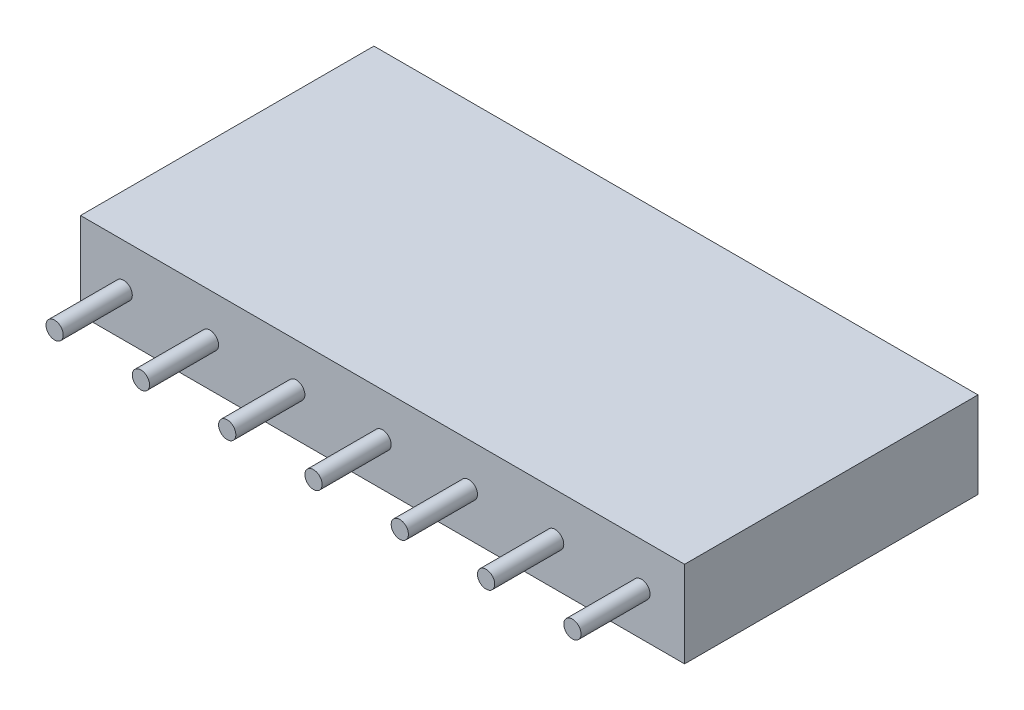
from build123d import *

# Parameters (mm, degrees)
ESQUISSE1_W                = 2.5
ESQUISSE1_H                = 2.5
BOSS_EXTRU_1_DEPTH         = 8.5
ESQUISSE2_R                = 0.25
BOSS_EXTRU_2_DEPTH         = 2
ESQUISSE3_R                = 0.25
ENL_V_MAT_EXTRU_2_DEPTH    = 4
R_P_TITION_LIN_AIRE1_COUNT = 7
R_P_TITION_LIN_AIRE1_PITCH = 2.5


with BuildPart() as part:
    # Esquisse1 → Boss.-Extru.1 (new body)
    with BuildSketch(Plane.XY):
        with Locations((-1.25, 1.25)):
            Rectangle(ESQUISSE1_W, ESQUISSE1_H)
    boss_extru_1 = extrude(amount=BOSS_EXTRU_1_DEPTH)

    # Esquisse2 → Boss.-Extru.2 (add)
    with BuildSketch(Plane.XY.offset(8.5)):
        with Locations((-1.25, 1.25)):
            Circle(ESQUISSE2_R)
    boss_extru_2 = extrude(amount=BOSS_EXTRU_2_DEPTH)

    # Esquisse3 → Enlèv. mat.-Extru.2 (cut)
    with BuildSketch(Plane(origin=(0, 0, 0), x_dir=(-1, 0, 0), z_dir=(0, 0, -1))):
        with Locations(Location((1.25, 1.25, 0), (0, 0, 180))):
            Circle(ESQUISSE3_R)
    enl_v_mat_extru_2 = extrude(amount=-ENL_V_MAT_EXTRU_2_DEPTH, mode=Mode.SUBTRACT)

    # Répétition linéaire1: Boss.-Extru.1, Boss.-Extru.2, Enlèv. mat.-Extru.2 ×7
    with Locations(*[(-i * R_P_TITION_LIN_AIRE1_PITCH, 0, 0) for i in range(1, R_P_TITION_LIN_AIRE1_COUNT)]):
        add(boss_extru_1)
        add(boss_extru_2)
        add(enl_v_mat_extru_2, mode=Mode.SUBTRACT)


solid = part.part
